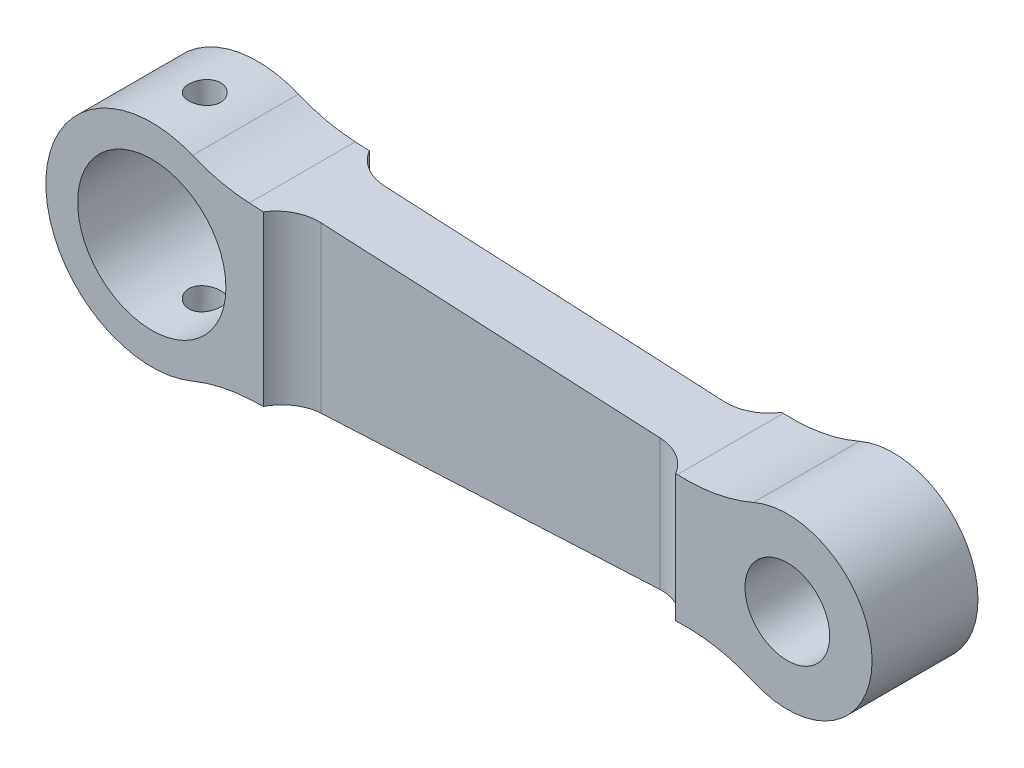
from build123d import *

# Parameters (mm, degrees)
ESQUISSE1_R             = 2
ESQUISSE1_R_2           = 3.5
BASE_EXTRUSION_DEPTH    = 2.5
ESQUISSE2_R             = 0.75
ENL_V_MAT_EXTRU_1_DEPTH = 10


with BuildPart() as part:
    # Esquisse1 → Base-Extrusion (new, symmetric)
    with BuildSketch(Plane.XY):
        with BuildLine():
            Line((4.604526211, -4.009780949), (24.808694688, -3.009780949))
            ThreePointArc((24.808694688, -3.009780949), (26.64302969, -3.130458818), (28.401389492, -3.666666667))
            ThreePointArc((28.401389492, -3.666666667), (34, 0), (28.401389492, 3.666666667))
            ThreePointArc((28.401389492, 3.666666667), (26.64302969, 3.130458818), (24.808694688, 3.009780949))
            Line((24.808694688, 3.009780949), (4.604526211, 4.009780949))
            ThreePointArc((4.604526211, 4.009780949), (3.237594273, 4.196543967), (1.923076923, 4.615384615))
            ThreePointArc((1.923076923, 4.615384615), (-5, 0), (1.923076923, -4.615384615))
            ThreePointArc((1.923076923, -4.615384615), (3.237594273, -4.196543967), (4.604526211, -4.009780949))
        make_face()
        with Locations((30, 0)):
            Circle(ESQUISSE1_R, mode=Mode.SUBTRACT)
        Circle(ESQUISSE1_R_2, mode=Mode.SUBTRACT)
    extrude(amount=BASE_EXTRUSION_DEPTH, both=True)

    # Esquisse2 → Enlèv. mat.-Extru.1 (cut, symmetric)
    with BuildSketch(Plane(origin=(0, 0, 0), x_dir=(1, 0, 0), z_dir=(0, 1, 0))):
        with Locations(Location((0, 0, 0), (0, 0, 270))):
            Circle(ESQUISSE2_R)
        with BuildLine():
            Line((5, 6.563022401), (25, 6.563022401))
            Line((25, 6.563022401), (25, 3.5))
            ThreePointArc((25, 3.5), (24.414213562, 2.085786438), (23, 1.5))
            Line((23, 1.5), (7, 1.5))
            ThreePointArc((7, 1.5), (5.585786438, 2.085786438), (5, 3.5))
            Line((5, 3.5), (5, 6.563022401))
        make_face()
        with BuildLine():
            Line((5, -5.954530257), (25, -5.954530257))
            Line((25, -5.954530257), (25, -3.5))
            ThreePointArc((25, -3.5), (24.414213562, -2.085786438), (23, -1.5))
            Line((23, -1.5), (7, -1.5))
            ThreePointArc((7, -1.5), (5.585786438, -2.085786438), (5, -3.5))
            Line((5, -3.5), (5, -5.954530257))
        make_face()
    extrude(amount=ENL_V_MAT_EXTRU_1_DEPTH, both=True, mode=Mode.SUBTRACT)


solid = part.part
